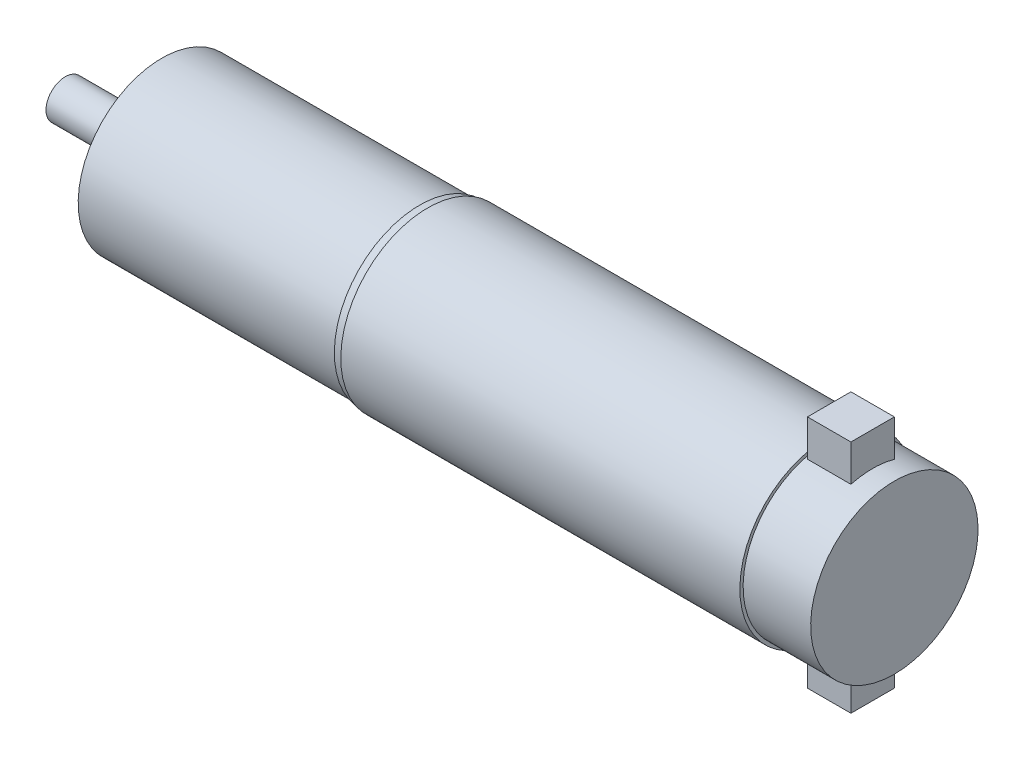
from build123d import *

# Parameters (mm, degrees)
SKETCH1_W           = 21
SKETCH1_H           = 26
SKETCH1_W_2         = 28
SKETCH1_H_2         = 6
BOSS_EXTRUDE1_START = 26
SKETCH2_W           = 13.5
SKETCH2_H           = 13.5
BOSS_EXTRUDE1_DEPTH = 36.5


with BuildPart() as part:
    # Sketch1 → Revolve1 (revolve)
    with BuildSketch(Plane.XY, mode=Mode.PRIVATE) as revolve1_sk:
        with Locations((217.1, 39)):
            Rectangle(SKETCH1_W, SKETCH1_H)
        Polygon((82.6, 52.5), (82.6, 26), (206.6, 26), (206.6, 52), (206.6, 53), (82.6, 53), align=None)
        Polygon((80.1, 52), (80.1, 26), (82.6, 26), (82.6, 52.5), (80.1, 52.5), align=None)
        Polygon((0, 42), (0, 26), (80.1, 26), (80.1, 52), (0, 52), align=None)
        Polygon((-2, 32), (-2, 26), (0, 26), (0, 42), (-2, 42), align=None)
        with Locations((-16, 29)):
            Rectangle(SKETCH1_W_2, SKETCH1_H_2)
    revolve(revolve1_sk.sketch.rotate(Axis((-30, 26, 0), (1, 0, 0)), 180), axis=Axis((-30, 26, 0), (1, 0, 0)))

    # Sketch2 → Boss-Extrude1 (add, symmetric)
    with BuildSketch(Plane(origin=(0, 0, 0), x_dir=(1, 0, 0), z_dir=(0, 1, 0)).offset(BOSS_EXTRUDE1_START)):
        with Locations((214.1, 0)):
            Rectangle(SKETCH2_W, SKETCH2_H)
    extrude(amount=BOSS_EXTRUDE1_DEPTH, both=True)


solid = part.part
